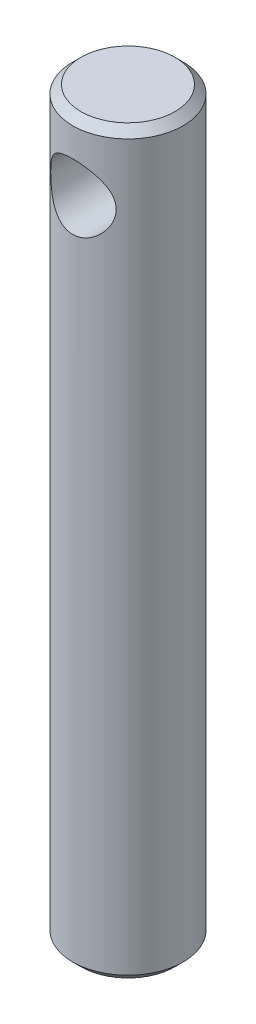
from build123d import *

# Parameters (mm, degrees)
SKETCH1_R               = 13.5
BOSS_EXTRUDE1_DEPTH     = 181
CUT_EXTRUDE1_DEPTH      = 183.004120832
CUT_EXTRUDE1_DEPTH_BACK = 183.004120832
SKETCH2_R               = 8
CHAMFER1_SIZE           = 2


with BuildPart() as part:
    # Sketch1 → Boss-Extrude1 (new body)
    with BuildSketch(Plane(origin=(0, 0, 0), x_dir=(1, 0, 0), z_dir=(0, 1, 0))):
        with Locations(Location((0, 0, 0), (0, 0, 270))):
            Circle(SKETCH1_R)
    extrude(amount=BOSS_EXTRUDE1_DEPTH)

    # Sketch2 → Cut-Extrude1 (cut, two sides: drawn at the far end of the back side and taken through both)
    with BuildSketch(Plane.XY.offset(-CUT_EXTRUDE1_DEPTH_BACK)):
        with Locations((0, 164)):
            Circle(SKETCH2_R)
    extrude(amount=CUT_EXTRUDE1_DEPTH + CUT_EXTRUDE1_DEPTH_BACK, mode=Mode.SUBTRACT)

    # Chamfer1
    chamfer1_edges = [part.edges().sort_by_distance(p)[0] for p in [
        (0, 0, -13.5),
        (0, 181, -13.5),
    ]]
    chamfer(chamfer1_edges, length=CHAMFER1_SIZE)


solid = part.part
